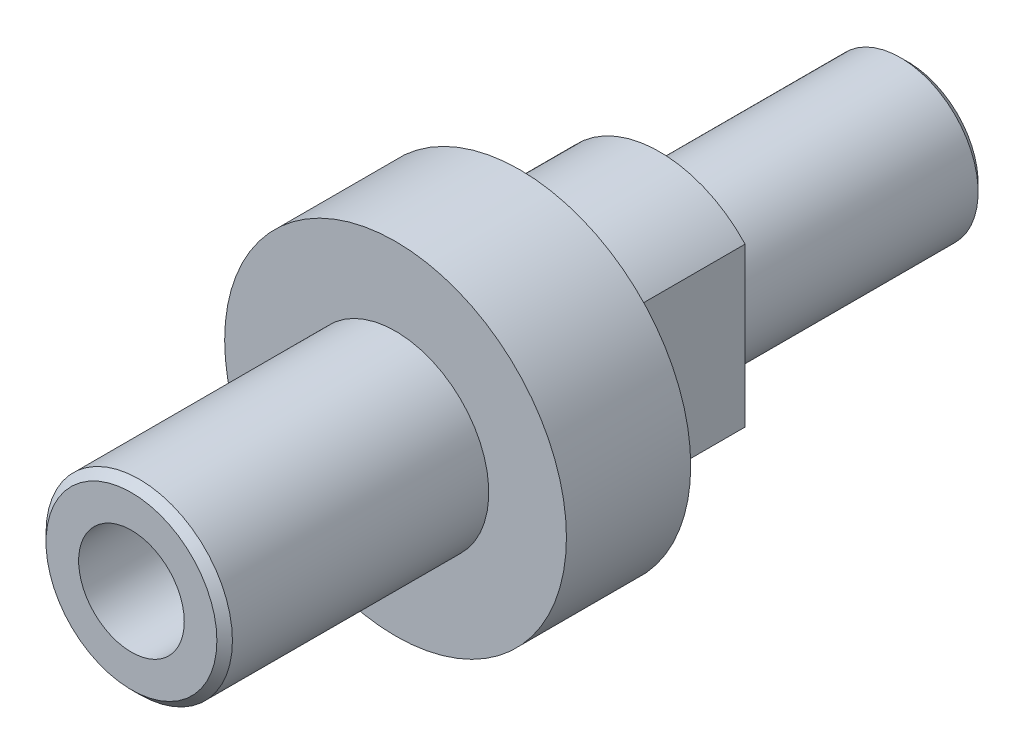
from build123d import *

# Parameters (mm, degrees)
SKETCH_2_OUTSIDE_W   = 35.778
SKETCH_2_OUTSIDE_H   = 35.778
SKETCH_2_OUTSIDE_W_2 = 11
SKETCH_2_OUTSIDE_H_2 = 17.627531483
CUT_EXTRUDE_1_DEPTH  = 9
M8X1_25_1_D          = 6.8
M8X1_25_1_DEPTH      = 19.75
M8X1_25_1_TIP        = 2.042926105
CHAMFER_1_SIZE       = 0.5


with BuildPart() as part:
    # 草图1 → 旋转1 (revolve)
    with BuildSketch(Plane(origin=(0, 0, 0), x_dir=(0, 0, -1), z_dir=(1, 0, 0)), mode=Mode.PRIVATE) as revolve_1_sk:
        Polygon((0, 6), (17, 6), (17, 11), (25, 11), (25, 7.5), (34, 7.5), (34, 5), (50, 5), (50, 0), (0, 0), align=None)
    revolve(revolve_1_sk.sketch.rotate(Axis((0, 0, -50), (0, 0, 1)), 90), axis=Axis((0, 0, -50), (0, 0, 1)))

    # 草图2 outside → 切除-拉伸1 (cut)
    with BuildSketch(Plane.XY.offset(-34)):
        Rectangle(SKETCH_2_OUTSIDE_W, SKETCH_2_OUTSIDE_H)
        with Locations((0, -0.228588755)):
            Rectangle(SKETCH_2_OUTSIDE_W_2, SKETCH_2_OUTSIDE_H_2, mode=Mode.SUBTRACT)
    extrude(amount=CUT_EXTRUDE_1_DEPTH, mode=Mode.SUBTRACT)

    # M8x1.25 螺纹孔1
    with Locations(Plane.XY):
        with Locations((0, 0)):
            Hole(M8X1_25_1_D / 2, depth=M8X1_25_1_DEPTH)
            with Locations((0, 0, -(M8X1_25_1_DEPTH + M8X1_25_1_TIP / 2))):  # 118° drill point
                Cone(0, M8X1_25_1_D / 2, M8X1_25_1_TIP, mode=Mode.SUBTRACT)

    # 倒角1
    chamfer_1_edges = [part.edges().sort_by_distance(p)[0] for p in [
        (6, 0, 0),
        (5, 0, -50),
    ]]
    chamfer(chamfer_1_edges, length=CHAMFER_1_SIZE)


solid = part.part
